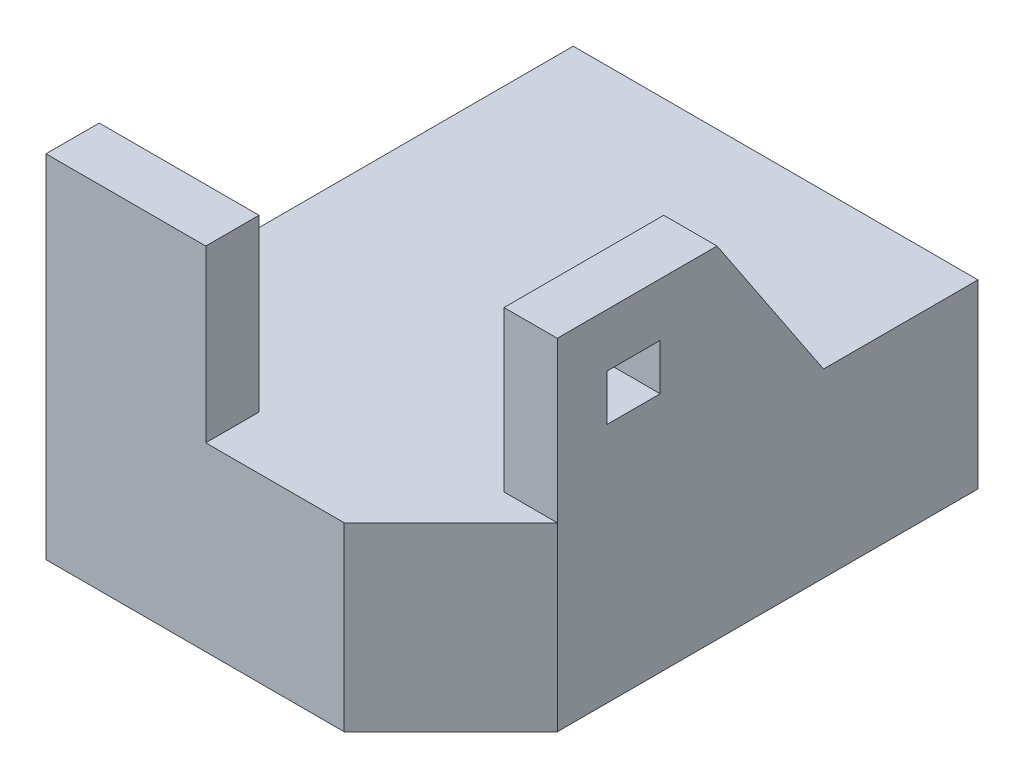
from build123d import *

# Parameters (mm, degrees)
BOSS_EXTRUDE1_DEPTH = 863.6
SKETCH4_W           = 762
SKETCH4_H           = 254
BOSS_EXTRUDE2_DEPTH = 812.8
SKETCH8_W           = 254
SKETCH8_H           = 220.666548299
BOSS_EXTRUDE4_DEPTH = 254


with BuildPart() as part:
    # Sketch1 → Boss-Extrude1 (new body)
    with BuildSketch(Plane(origin=(0, 0, 0), x_dir=(1, 0, 0), z_dir=(0, 1, 0))):
        Polygon((0, 0), (0, -2514.6), (1422.4, -2514.6), (1930.4, -2006.6), (1930.4, 0), align=None)
    extrude(amount=BOSS_EXTRUDE1_DEPTH)

    # Sketch4 → Boss-Extrude2 (add)
    with BuildSketch(Plane(origin=(0, 863.6, 0), x_dir=(1, 0, 0), z_dir=(0, 1, 0))):
        with Locations((381, -2387.6)):
            Rectangle(SKETCH4_W, SKETCH4_H)
    extrude(amount=BOSS_EXTRUDE2_DEPTH)

    # Sketch8 → Boss-Extrude4 (add)
    with BuildSketch(Plane(origin=(1930.4, 0, 0), x_dir=(0, 0, -1), z_dir=(1, 0, 0))):
        Polygon((-2006.6, 863.6), (-736.6, 863.6), (-1244.6, 1625.6), (-2006.6, 1625.6), align=None)
        with Locations((-1642.786067738, 1261.266725851)):
            Rectangle(SKETCH8_W, SKETCH8_H, mode=Mode.SUBTRACT)
    extrude(amount=-BOSS_EXTRUDE4_DEPTH)


solid = part.part
